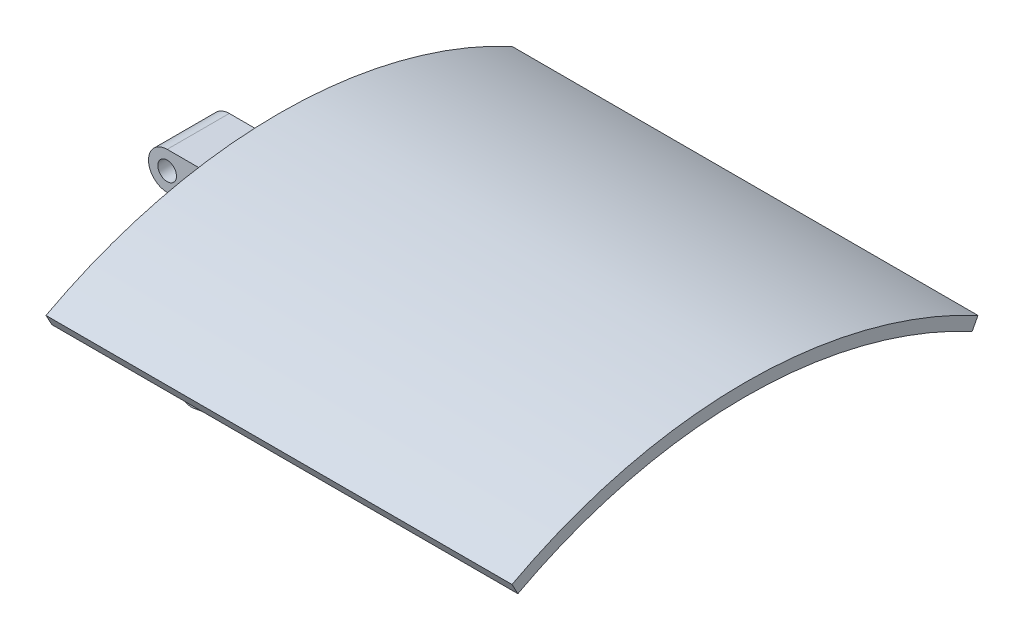
from build123d import *

# Parameters (mm, degrees)
BOSS_EXTRU_1_DEPTH      = 75
BOSS_EXTRU_3_DEPTH      = 5
BOSS_EXTRU_3_DEPTH_BACK = 5
ESQUISSE7_R             = 1.5
BOSS_EXTRU_2_DEPTH      = 3
BOSS_EXTRU_2_DEPTH_BACK = 3
ESQUISSE3_R             = 1.5


with BuildPart() as part:
    # Esquisse1 → Boss.-Extru.1 (new body)
    with BuildSketch(Plane(origin=(0, 0, 0), x_dir=(0, 0, -1), z_dir=(1, 0, 0))):
        with BuildLine():
            Line((-37.5, 70.099928673), (-36.556603774, 68.336408455))
            ThreePointArc((-36.556603774, 68.336408455), (0, 77.5), (36.556603774, 68.336408455))
            Line((36.556603774, 68.336408455), (37.5, 70.099928673))
            ThreePointArc((37.5, 70.099928673), (0, 79.5), (-37.5, 70.099928673))
        make_face()
    extrude(amount=BOSS_EXTRU_1_DEPTH)

    # Esquisse7 → Boss.-Extru.3 (add, two sides: drawn at the far end of the back side and taken through both)
    with BuildSketch(Plane.XY.offset(-BOSS_EXTRU_3_DEPTH_BACK)):
        with BuildLine():
            Line((7, 77.5), (7, 70.5))
            Line((7, 70.5), (-13, 70.5))
            ThreePointArc((-13, 70.5), (-16, 67.5), (-13, 64.5))
            Line((-13, 64.5), (13, 64.5))
            Line((13, 64.5), (13, 77.5))
            Line((13, 77.5), (7, 77.5))
        make_face()
        with Locations((-13, 67.5)):
            Circle(ESQUISSE7_R, mode=Mode.SUBTRACT)
    extrude(amount=BOSS_EXTRU_3_DEPTH + BOSS_EXTRU_3_DEPTH_BACK)

    # Esquisse3 → Boss.-Extru.2 (add, two sides: drawn at the far end of the back side and taken through both)
    with BuildSketch(Plane.XY.offset(-BOSS_EXTRU_2_DEPTH_BACK)):
        with BuildLine():
            Line((30.72135955, 77.5), (30.72135955, 72.5))
            add(Edge.make_bspline(
                [(30.72135955, 72.5), (30.72135955, 44.694963761), (24.910353183, 46.831964153), (-11, 40.5)],
                knots=[0, 0, 0, 0, 1, 1, 1, 1], degree=3))
            ThreePointArc((-11, 40.5), (-14, 37.5), (-11, 34.5))
            add(Edge.make_bspline(
                [(36.72135955, 72.5), (36.72135955, 41.406516096), (28.397257564, 41.446799475), (-11, 34.5)],
                knots=[0, 0, 0, 0, 1, 1, 1, 1], degree=3))
            Line((36.72135955, 72.5), (36.72135955, 77.5))
            Line((36.72135955, 77.5), (30.72135955, 77.5))
        make_face()
        with Locations((-11, 37.5)):
            Circle(ESQUISSE3_R, mode=Mode.SUBTRACT)
    extrude(amount=BOSS_EXTRU_2_DEPTH + BOSS_EXTRU_2_DEPTH_BACK)


solid = part.part
